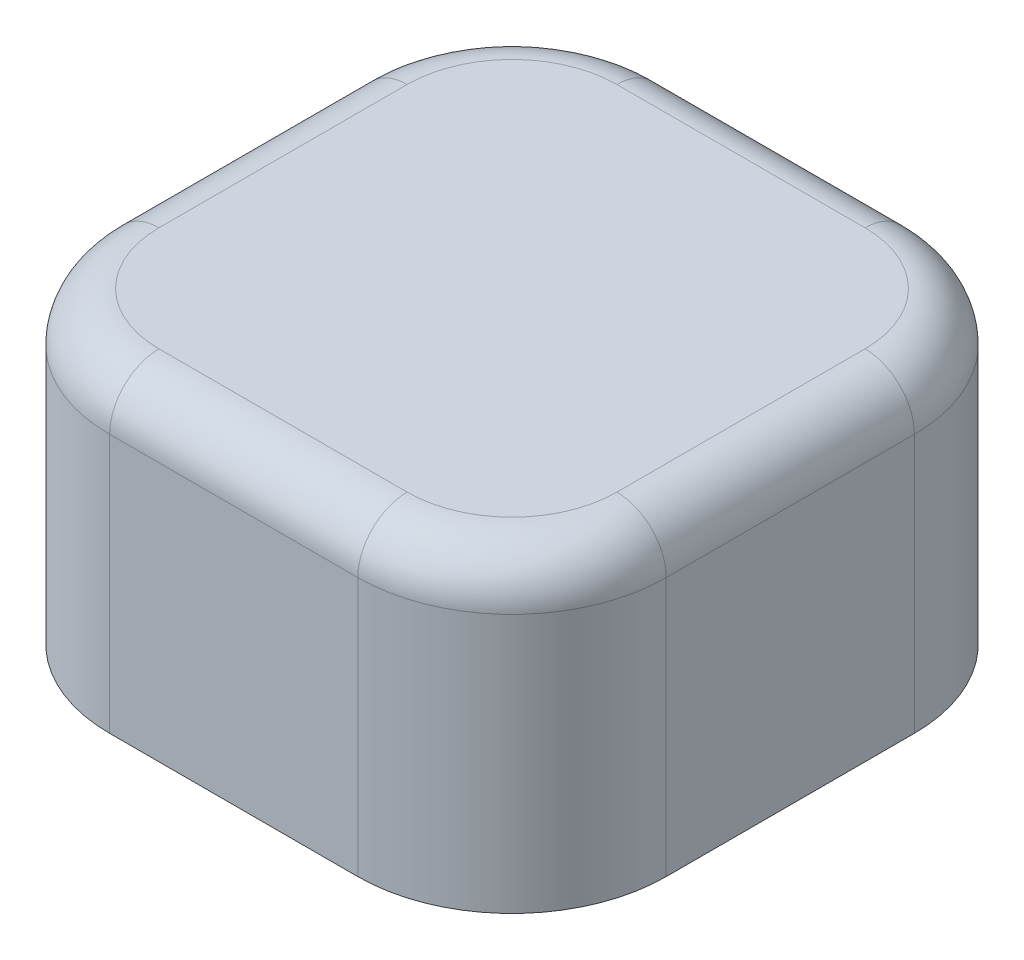
from build123d import *

# Parameters (mm, degrees)
SKETCH_1_R      = 2.8
EXTRUDE_1_DEPTH = 8
SKETCH_2_W      = 18.05
SKETCH_2_H      = 18.05
EXTRUDE_2_DEPTH = 1
SKETCH_3_W      = 18.05
SKETCH_3_H      = 18.05
SKETCH_3_W_2    = 16.05
SKETCH_3_H_2    = 16.05
EXTRUDE_3_DEPTH = 9
SKETCH_6_W      = 1.2
SKETCH_6_H      = 5.825
SKETCH_6_W_2    = 5.825
SKETCH_6_H_2    = 1.2
EXTRUDE_4_DEPTH = 2.5
FILLET_3_R      = 5
FILLET_4_R      = 1.6


with BuildPart() as part:
    # 草图1 → 凸台-拉伸1 (new body)
    with BuildSketch(Plane(origin=(0, 0, 0), x_dir=(1, 0, 0), z_dir=(0, 1, 0))):
        with Locations(Location((0, 0, 0), (0, 0, 270))):
            Circle(SKETCH_1_R)
        Polygon((2.2, 0.6), (2.2, -0.6), (0.6, -0.6), (0.6, -2.2), (-0.6, -2.2), (-0.6, -0.6), (-2.2, -0.6), (-2.2, 0.6), (-0.6, 0.6), (-0.6, 2.2), (0.6, 2.2), (0.6, 0.6), align=None, mode=Mode.SUBTRACT)
    extrude(amount=-EXTRUDE_1_DEPTH)

    # 草图2 → 凸台-拉伸2 (add)
    with BuildSketch(Plane(origin=(0, 0, 0), x_dir=(1, 0, 0), z_dir=(0, 1, 0))):
        Rectangle(SKETCH_2_W, SKETCH_2_H)
    extrude(amount=EXTRUDE_2_DEPTH)

    # 草图3 → 凸台-拉伸3 (add)
    with BuildSketch(Plane(origin=(0, 0, 0), x_dir=(1, 0, 0), z_dir=(0, 1, 0))):
        Rectangle(SKETCH_3_W, SKETCH_3_H)
        Rectangle(SKETCH_3_W_2, SKETCH_3_H_2, mode=Mode.SUBTRACT)
    extrude(amount=-EXTRUDE_3_DEPTH)

    # 草图6 → 凸台-拉伸4 (add)
    with BuildSketch(Plane(origin=(0, 0, 0), x_dir=(1, 0, 0), z_dir=(0, 1, 0))):
        with Locations((0, 5.1125)):
            Rectangle(SKETCH_6_W, SKETCH_6_H)
        with Locations((5.1125, 0)):
            Rectangle(SKETCH_6_W_2, SKETCH_6_H_2)
        with Locations((0, -5.1125)):
            Rectangle(SKETCH_6_W, SKETCH_6_H)
        with Locations((-5.1125, 0)):
            Rectangle(SKETCH_6_W_2, SKETCH_6_H_2)
    extrude(amount=-EXTRUDE_4_DEPTH)

    # 圆角3
    fillet_3_edges = [part.edges().sort_by_distance(p)[0] for p in [
        (9.025, -4, 9.025),
        (9.025, -4, -9.025),
        (-9.025, -4, -9.025),
        (-9.025, -4, 9.025),
        (-8.025, -4.5, 8.025),
        (-8.025, -4.5, -8.025),
        (8.025, -4.5, -8.025),
        (8.025, -4.5, 8.025),
    ]]
    fillet(fillet_3_edges, radius=FILLET_3_R)

    # 圆角4
    fillet_4_edges = [part.edges().sort_by_distance(p)[0] for p in [
        (-8.025, 0, 1.8125),
        (-1.8125, 0, -8.025),
        (8.025, 0, -1.8125),
        (8.025, 0, 1.8125),
        (6.560533906, 0, 6.560533906),
        (-1.8125, 0, 8.025),
        (-6.560533906, 0, 6.560533906),
        (-8.025, 0, -1.8125),
        (-6.560533906, 0, -6.560533906),
        (1.8125, 0, -8.025),
        (6.560533906, 0, -6.560533906),
        (0, 1, 9.025),
        (-9.025, 1, 0),
        (9.025, 1, 0),
        (0, 1, -9.025),
        (-7.560533906, 1, -7.560533906),
        (7.560533906, 1, -7.560533906),
        (7.560533906, 1, 7.560533906),
        (-7.560533906, 1, 7.560533906),
        (1.8125, 0, 8.025),
    ]]
    fillet(fillet_4_edges, radius=FILLET_4_R)


solid = part.part
